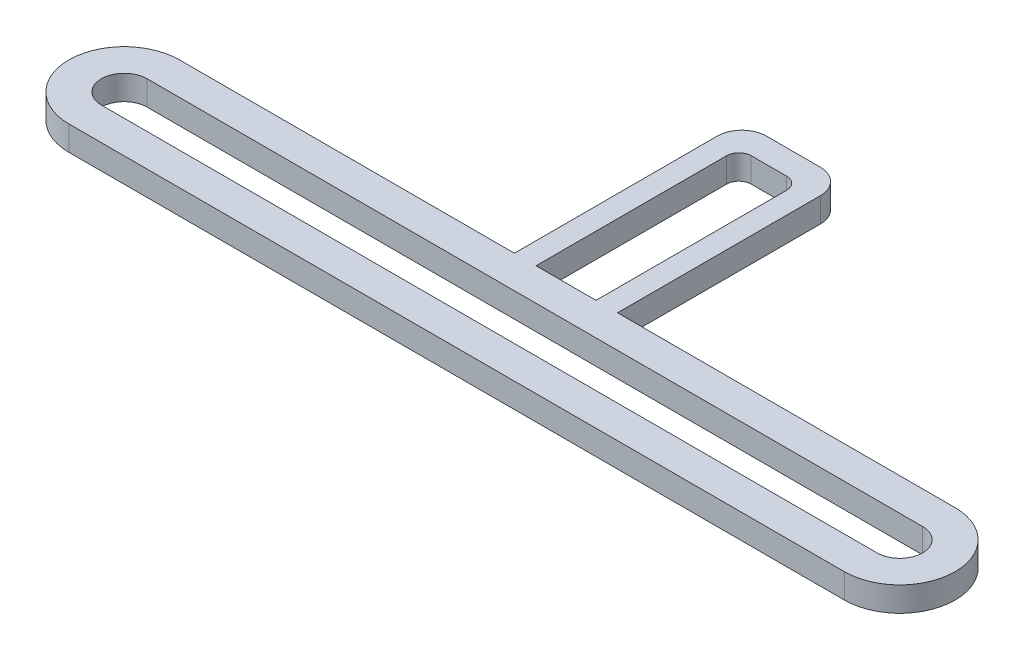
from build123d import *

# Parameters (mm, degrees)
BOSS_EXTRUDE10_DEPTH = 1.27


with BuildPart() as part:
    # Sketch1 → Boss-Extrude10 (new, symmetric)
    with BuildSketch(Plane(origin=(0, 0, 0), x_dir=(1, 0, 0), z_dir=(0, 1, 0))):
        with BuildLine():
            Line((-40.034645199, 5.723587865), (-5.476888276, 5.723587865))
            Line((-5.476888276, 5.723587865), (-5.476888276, 26.661855827))
            ThreePointArc((-5.476888276, 26.661855827), (-4.732939501, 28.457907051), (-2.936888276, 29.201855827))
            Line((-2.936888276, 29.201855827), (2.631615538, 29.201855827))
            ThreePointArc((2.631615538, 29.201855827), (4.427666762, 28.457907051), (5.171615538, 26.661855827))
            Line((5.171615538, 26.661855827), (5.171615538, 5.723587865))
            Line((5.171615538, 5.723587865), (40.023244529, 5.723587865))
            ThreePointArc((40.023244529, 5.723587865), (45.741799588, 0.005032806), (40.023244529, -5.713522253))
            Line((40.023244529, -5.713522253), (-40.034645199, -5.713522253))
            ThreePointArc((-40.034645199, -5.713522253), (-45.753200258, 0.005032806), (-40.034645199, 5.723587865))
        make_face()
        with BuildLine():
            Line((-40.034645199, 2.362682699), (40.023244529, 2.362682699))
            ThreePointArc((40.023244529, 2.362682699), (42.380894421, 0.005032806), (40.023244529, -2.352617087))
            Line((40.023244529, -2.352617087), (-40.034645199, -2.352617087))
            ThreePointArc((-40.034645199, -2.352617087), (-42.392295092, 0.005032806), (-40.034645199, 2.362682699))
        make_face(mode=Mode.SUBTRACT)
        with BuildLine():
            Line((-3.238670488, 5.723587865), (2.946447825, 5.723587865))
            Line((2.946447825, 5.723587865), (2.946447825, 25.391855827))
            ThreePointArc((2.946447825, 25.391855827), (2.574473437, 26.289881439), (1.676447825, 26.661855827))
            Line((1.676447825, 26.661855827), (-1.968670488, 26.661855827))
            ThreePointArc((-1.968670488, 26.661855827), (-2.8666961, 26.289881439), (-3.238670488, 25.391855827))
            Line((-3.238670488, 25.391855827), (-3.238670488, 5.723587865))
        make_face(mode=Mode.SUBTRACT)
    extrude(amount=BOSS_EXTRUDE10_DEPTH, both=True)


solid = part.part
